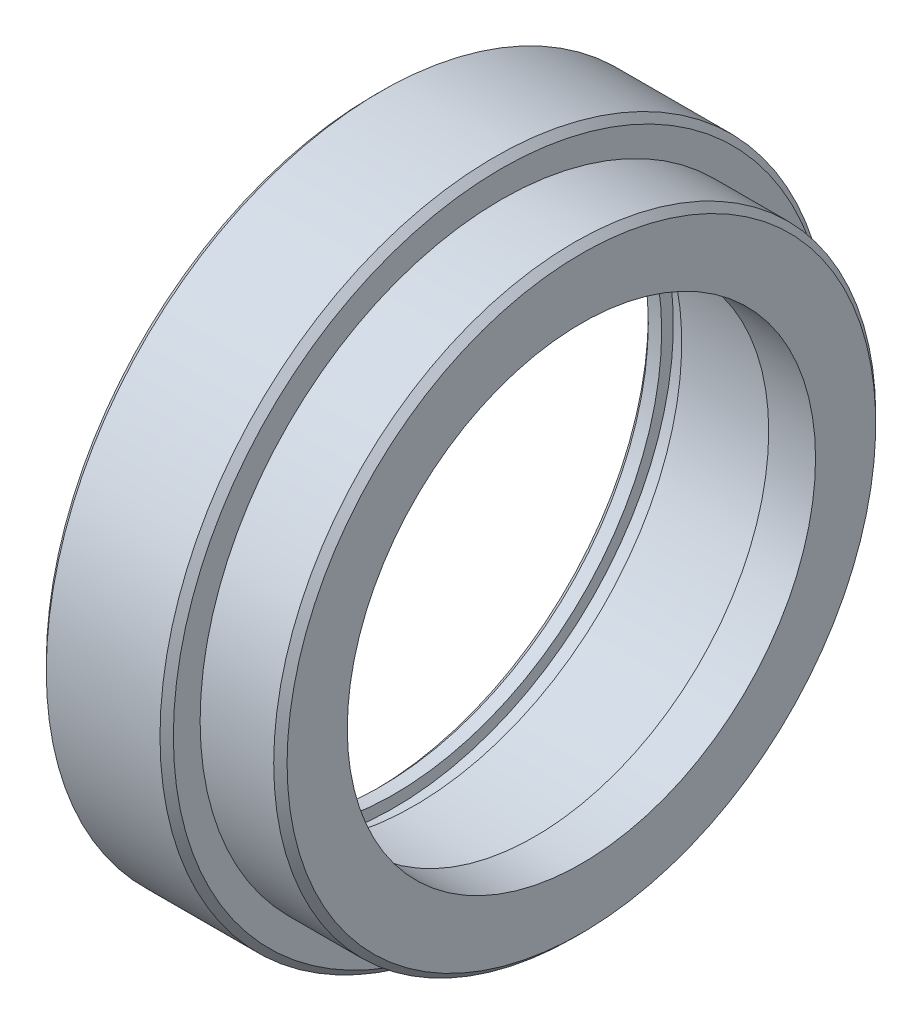
from build123d import *

# Parameters (mm, degrees)
CHAMFER_1_SIZE = 1
SKETCH_2_W     = 3
SKETCH_2_H     = 41.75


with BuildPart() as part:
    # Эскиз1 → Повернуть1 (revolve)
    with BuildSketch(Plane.XY, mode=Mode.PRIVATE) as revolve_1_sk:
        Polygon((31, 35), (31, 45), (19, 45), (19, 50), (0, 50), (0, 40), (24, 40), (24, 35), align=None)
    revolve(revolve_1_sk.sketch.rotate(Axis((0, 0, 0), (1, 0, 0)), 90), axis=Axis((0, 0, 0), (1, 0, 0)))

    # Фаска1
    chamfer_1_edges = [part.edges().sort_by_distance(p)[0] for p in [
        (31, 0, -45),
        (0, 0, -40),
        (0, 0, -50),
        (19, 0, -50),
    ]]
    chamfer(chamfer_1_edges, length=CHAMFER_1_SIZE)

    # Эскиз2 → Вырез-Повернуть1 (revolve, cut)
    with BuildSketch(Plane.XY, mode=Mode.PRIVATE) as cut_revolve_1_sk:
        with Locations((4.5, 20.875)):
            Rectangle(SKETCH_2_W, SKETCH_2_H)
    revolve(cut_revolve_1_sk.sketch.rotate(Axis((0, 0, 0), (1, 0, 0)), 270), axis=Axis((0, 0, 0), (1, 0, 0)), mode=Mode.SUBTRACT)


solid = part.part
